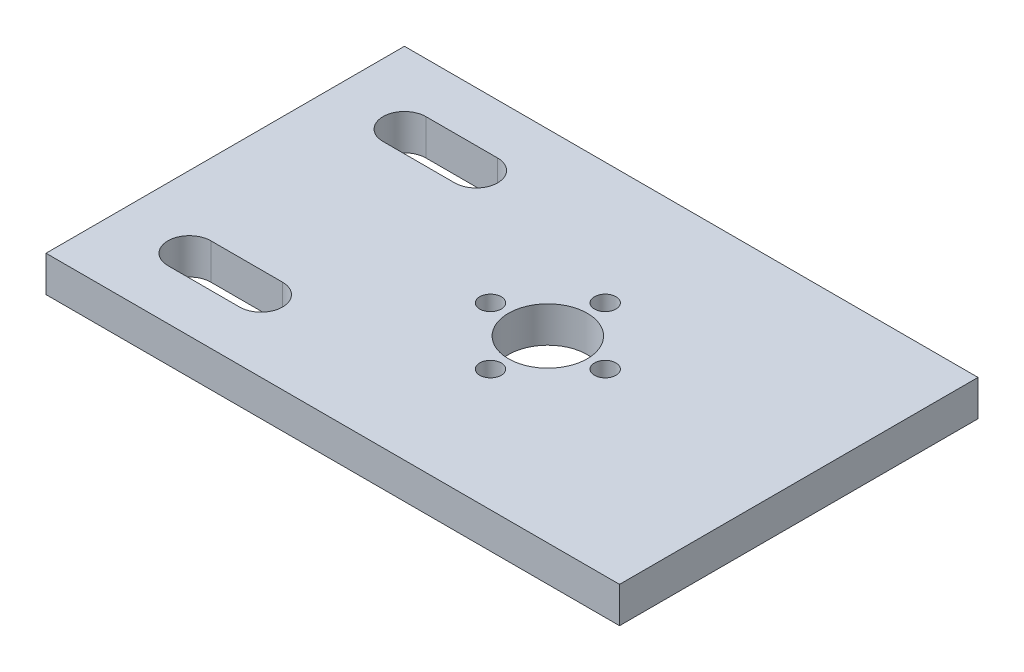
from build123d import *

# Parameters (mm, degrees)
SKETCH1_W           = 80
SKETCH1_H           = 50
SKETCH1_R           = 5.5
BOSS_EXTRUDE1_DEPTH = 5
SKETCH3_R           = 1.5
CUT_EXTRUDE1_DEPTH  = 5


with BuildPart() as part:
    # Sketch1 → Boss-Extrude1 (new body)
    with BuildSketch(Plane(origin=(0, 0, 0), x_dir=(1, 0, 0), z_dir=(0, 1, 0))):
        with Locations((40, 25)):
            Rectangle(SKETCH1_W, SKETCH1_H)
        with Locations(Location((45, 25, 0), (0, 0, 270))):
            Circle(SKETCH1_R, mode=Mode.SUBTRACT)
        with BuildLine():
            Line((10, 43), (20, 43))
            ThreePointArc((20, 43), (23, 40), (20, 37))
            Line((20, 37), (10, 37))
            ThreePointArc((10, 37), (7, 40), (10, 43))
        make_face(mode=Mode.SUBTRACT)
        with BuildLine():
            Line((10, 13), (20, 13))
            ThreePointArc((20, 13), (23, 10), (20, 7))
            Line((20, 7), (10, 7))
            ThreePointArc((10, 7), (7, 10), (10, 13))
        make_face(mode=Mode.SUBTRACT)
    extrude(amount=BOSS_EXTRUDE1_DEPTH)

    # Sketch3 → Cut-Extrude1 (cut)
    with BuildSketch(Plane.XZ):
        with Locations(Location((45, -17, 0), (0, 0, 270))):
            Circle(SKETCH3_R)
        with Locations(Location((53, -25, 0), (0, 0, 270))):
            Circle(SKETCH3_R)
        with Locations(Location((45, -33, 0), (0, 0, 270))):
            Circle(SKETCH3_R)
        with Locations(Location((37, -25, 0), (0, 0, 270))):
            Circle(SKETCH3_R)
    extrude(amount=-CUT_EXTRUDE1_DEPTH, mode=Mode.SUBTRACT)


solid = part.part
